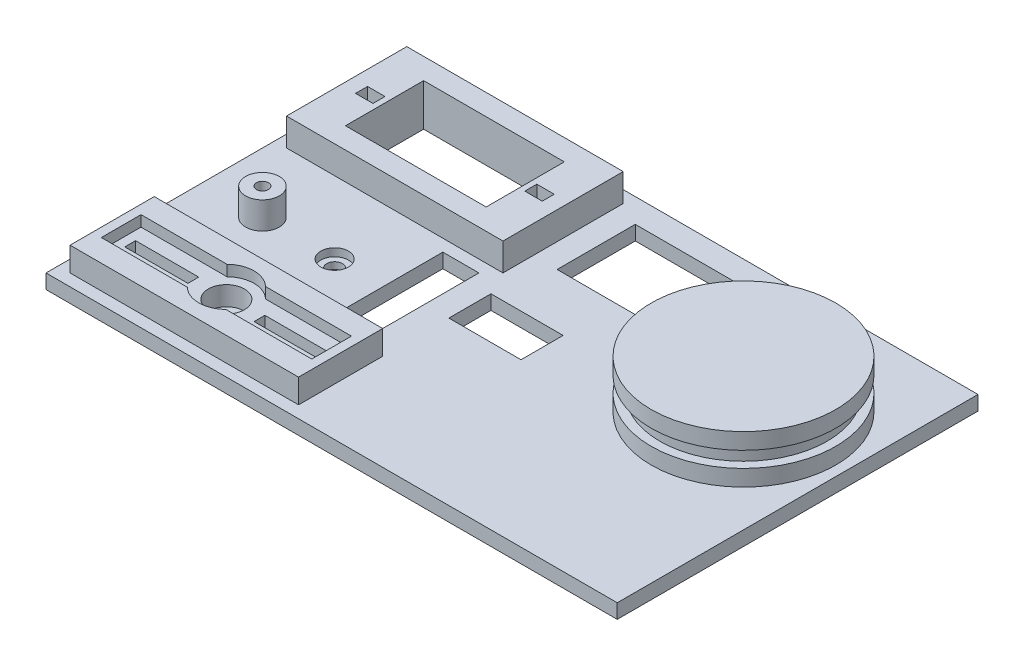
from build123d import *

# Parameters (mm, degrees)
SKETCH1_W            = 95
SKETCH1_H            = 2.4
BOSS_EXTRUDE1_DEPTH  = 60
BOSS_EXTRUDE2_START  = 2
SKETCH2_W            = 36
SKETCH2_H            = 4.6
BOSS_EXTRUDE2_DEPTH  = 20
BOSS_EXTRUDE3_START  = 5.5
SKETCH3_W            = 23.4
SKETCH3_H            = 9
BOSS_EXTRUDE3_DEPTH  = 13
BOSS_EXTRUDE4_START  = 11
SKETCH4_W            = 2.9
SKETCH4_H            = 9
BOSS_EXTRUDE4_DEPTH  = 2
BOSS_EXTRUDE5_START  = 11
SKETCH5_W            = 2.9
SKETCH5_H            = 9
BOSS_EXTRUDE5_DEPTH  = 2
BOSS_EXTRUDE6_START  = 4
SKETCH6_W            = 19.4
SKETCH6_H            = 4.4
BOSS_EXTRUDE6_DEPTH  = 13
BOSS_EXTRUDE7_START  = 2.4
SKETCH7_R            = 2.8
BOSS_EXTRUDE7_DEPTH  = 4.5
BOSS_EXTRUDE8_START  = 1.6
SKETCH8_R            = 1
BOSS_EXTRUDE8_DEPTH  = 6.3
BOSS_EXTRUDE9_START  = -1
SKETCH9_R            = 1.3
BOSS_EXTRUDE9_DEPTH  = 4.4
BOSS_EXTRUDE10_START = 1.1
SKETCH10_R           = 2.3
BOSS_EXTRUDE10_DEPTH = 2.3
BOSS_EXTRUDE11_START = 24
SKETCH11_W           = 6
SKETCH11_H           = 4.4
BOSS_EXTRUDE11_DEPTH = 17
BOSS_EXTRUDE12_START = 26
SKETCH12_W           = 12
SKETCH12_H           = 4.4
BOSS_EXTRUDE12_DEPTH = 7
BOSS_EXTRUDE13_START = 2.4
SKETCH13_R           = 15.35
BOSS_EXTRUDE13_DEPTH = 8
BOSS_EXTRUDE14_START = 5.1
SKETCH14_R           = 20
BOSS_EXTRUDE14_DEPTH = 2.6
BOSS_EXTRUDE15_START = 5.1
SKETCH15_R           = 13.9
BOSS_EXTRUDE15_DEPTH = 2.6
BOSS_EXTRUDE16_START = 44
SKETCH16_W           = 38
SKETCH16_H           = 4
BOSS_EXTRUDE16_DEPTH = 14
BOSS_EXTRUDE17_START = 4.6
SKETCH17_R           = 4.6
BOSS_EXTRUDE17_DEPTH = 2.3
BOSS_EXTRUDE18_START = 47.7
SKETCH18_W           = 17.5
SKETCH18_H           = 2.3
BOSS_EXTRUDE18_DEPTH = 6.6
BOSS_EXTRUDE19_START = 50.1
SKETCH19_W           = 10.5
SKETCH19_H           = 6
BOSS_EXTRUDE19_DEPTH = 1.8
BOSS_EXTRUDE20_START = 47.7
SKETCH20_W           = 17.5
SKETCH20_H           = 2.3
BOSS_EXTRUDE20_DEPTH = 6.6
BOSS_EXTRUDE21_START = 50.1
SKETCH21_W           = 10.5
SKETCH21_H           = 6
BOSS_EXTRUDE21_DEPTH = 1.8
BOSS_EXTRUDE22_START = 1.4
SKETCH22_R           = 3
BOSS_EXTRUDE22_DEPTH = 6


with BuildPart() as part:
    # Sketch1 → Boss-Extrude1 (new body)
    with BuildSketch(Plane.XY):
        with Locations((197.5, 1.2)):
            Rectangle(SKETCH1_W, SKETCH1_H)
    extrude(amount=BOSS_EXTRUDE1_DEPTH)

    # Sketch2 → Boss-Extrude2 (add)
    with BuildSketch(Plane.XY.offset(BOSS_EXTRUDE2_START)):
        with Locations((170, 4.7)):
            Rectangle(SKETCH2_W, SKETCH2_H)
    extrude(amount=BOSS_EXTRUDE2_DEPTH)


with BuildPart() as body_2:
    # Sketch3 → Boss-Extrude3 (new body)
    with BuildSketch(Plane.XY.offset(BOSS_EXTRUDE3_START)):
        with Locations((170, 3.5)):
            Rectangle(SKETCH3_W, SKETCH3_H)
    extrude(amount=BOSS_EXTRUDE3_DEPTH)


with BuildPart() as part_1:
    add(part.part)

    # Combine1: cut body 2
    add(body_2.part, mode=Mode.SUBTRACT)


with BuildPart() as body_2_2:
    # Sketch4 → Boss-Extrude4 (new body)
    with BuildSketch(Plane.XY.offset(BOSS_EXTRUDE4_START)):
        with Locations((155.925, 3.5)):
            Rectangle(SKETCH4_W, SKETCH4_H)
    extrude(amount=BOSS_EXTRUDE4_DEPTH)


with BuildPart() as part_2:
    add(part_1.part)

    # Combine2: cut body 2 2
    add(body_2_2.part, mode=Mode.SUBTRACT)


with BuildPart() as body_2_3:
    # Sketch5 → Boss-Extrude5 (new body)
    with BuildSketch(Plane.XY.offset(BOSS_EXTRUDE5_START)):
        with Locations((184.075, 3.5)):
            Rectangle(SKETCH5_W, SKETCH5_H)
    extrude(amount=BOSS_EXTRUDE5_DEPTH)


with BuildPart() as part_3:
    add(part_2.part)

    # Combine3: cut body 2 3
    add(body_2_3.part, mode=Mode.SUBTRACT)


with BuildPart() as body_2_4:
    # Sketch6 → Boss-Extrude6 (new body)
    with BuildSketch(Plane.XY.offset(BOSS_EXTRUDE6_START)):
        with Locations((201.7, 1.2)):
            Rectangle(SKETCH6_W, SKETCH6_H)
    extrude(amount=BOSS_EXTRUDE6_DEPTH)


with BuildPart() as part_4:
    add(part_3.part)

    # Combine4: cut body 2 4
    add(body_2_4.part, mode=Mode.SUBTRACT)

    # Sketch7 → Boss-Extrude7 (add)
    with BuildSketch(Plane(origin=(0, 0, 0), x_dir=(1, 0, 0), z_dir=(0, 1, 0)).offset(BOSS_EXTRUDE7_START)):
        with Locations(Location((160, -34, 0), (0, 0, 90))):
            Circle(SKETCH7_R)
    extrude(amount=BOSS_EXTRUDE7_DEPTH)


with BuildPart() as body_2_5:
    # Sketch8 → Boss-Extrude8 (new body)
    with BuildSketch(Plane(origin=(0, 0, 0), x_dir=(1, 0, 0), z_dir=(0, 1, 0)).offset(BOSS_EXTRUDE8_START)):
        with Locations(Location((160, -34, 0), (0, 0, 270))):
            Circle(SKETCH8_R)
    extrude(amount=BOSS_EXTRUDE8_DEPTH)


with BuildPart() as part_5:
    add(part_4.part)

    # Combine5: cut body 2 5
    add(body_2_5.part, mode=Mode.SUBTRACT)


with BuildPart() as body_2_6:
    # Sketch9 → Boss-Extrude9 (new body)
    with BuildSketch(Plane(origin=(0, 0, 0), x_dir=(1, 0, 0), z_dir=(0, 1, 0)).offset(BOSS_EXTRUDE9_START)):
        with Locations(Location((172, -34, 0), (0, 0, 270))):
            Circle(SKETCH9_R)
    extrude(amount=BOSS_EXTRUDE9_DEPTH)


with BuildPart() as part_6:
    add(part_5.part)

    # Combine6: cut body 2 6
    add(body_2_6.part, mode=Mode.SUBTRACT)


with BuildPart() as body_2_7:
    # Sketch10 → Boss-Extrude10 (new body)
    with BuildSketch(Plane(origin=(0, 0, 0), x_dir=(1, 0, 0), z_dir=(0, 1, 0)).offset(BOSS_EXTRUDE10_START)):
        with Locations(Location((172, -34, 0), (0, 0, 270))):
            Circle(SKETCH10_R)
    extrude(amount=BOSS_EXTRUDE10_DEPTH)


with BuildPart() as part_7:
    add(part_6.part)

    # Combine7: cut body 2 7
    add(body_2_7.part, mode=Mode.SUBTRACT)


with BuildPart() as body_2_8:
    # Sketch11 → Boss-Extrude11 (new body)
    with BuildSketch(Plane.XY.offset(BOSS_EXTRUDE11_START)):
        with Locations((183, 1.2)):
            Rectangle(SKETCH11_W, SKETCH11_H)
    extrude(amount=BOSS_EXTRUDE11_DEPTH)


with BuildPart() as part_8:
    add(part_7.part)

    # Combine8: cut body 2 8
    add(body_2_8.part, mode=Mode.SUBTRACT)


with BuildPart() as body_2_9:
    # Sketch12 → Boss-Extrude12 (new body)
    with BuildSketch(Plane.XY.offset(BOSS_EXTRUDE12_START)):
        with Locations((196, 1.2)):
            Rectangle(SKETCH12_W, SKETCH12_H)
    extrude(amount=BOSS_EXTRUDE12_DEPTH)


with BuildPart() as part_9:
    add(part_8.part)

    # Combine9: cut body 2 9
    add(body_2_9.part, mode=Mode.SUBTRACT)

    # Sketch13 → Boss-Extrude13 (add)
    with BuildSketch(Plane(origin=(0, 0, 0), x_dir=(1, 0, 0), z_dir=(0, 1, 0)).offset(BOSS_EXTRUDE13_START)):
        with Locations(Location((228, -22, 0), (0, 0, 90))):
            Circle(SKETCH13_R)
    extrude(amount=BOSS_EXTRUDE13_DEPTH)


with BuildPart() as body_2_10:
    # Sketch14 → Boss-Extrude14 (new body)
    with BuildSketch(Plane(origin=(0, 0, 0), x_dir=(1, 0, 0), z_dir=(0, 1, 0)).offset(BOSS_EXTRUDE14_START)):
        with Locations(Location((228, -22, 0), (0, 0, 270))):
            Circle(SKETCH14_R)
    extrude(amount=BOSS_EXTRUDE14_DEPTH)


with BuildPart() as part_10:
    add(part_9.part)

    # Combine10: cut body 2 10
    add(body_2_10.part, mode=Mode.SUBTRACT)

    # Sketch15 → Boss-Extrude15 (add)
    with BuildSketch(Plane(origin=(0, 0, 0), x_dir=(1, 0, 0), z_dir=(0, 1, 0)).offset(BOSS_EXTRUDE15_START)):
        with Locations(Location((228, -22, 0), (0, 0, 270))):
            Circle(SKETCH15_R)
    extrude(amount=BOSS_EXTRUDE15_DEPTH)

    # Sketch16 → Boss-Extrude16 (add)
    with BuildSketch(Plane.XY.offset(BOSS_EXTRUDE16_START)):
        with Locations((171, 4.4)):
            Rectangle(SKETCH16_W, SKETCH16_H)
    extrude(amount=BOSS_EXTRUDE16_DEPTH)


with BuildPart() as body_2_11:
    # Sketch17 → Boss-Extrude17 (new body)
    with BuildSketch(Plane(origin=(0, 0, 0), x_dir=(1, 0, 0), z_dir=(0, 1, 0)).offset(BOSS_EXTRUDE17_START)):
        with Locations(Location((171, -51, 0), (0, 0, 270))):
            Circle(SKETCH17_R)
    extrude(amount=BOSS_EXTRUDE17_DEPTH)


with BuildPart() as part_11:
    add(part_10.part)

    # Combine11: cut body 2 11
    add(body_2_11.part, mode=Mode.SUBTRACT)


with BuildPart() as body_2_12:
    # Sketch18 → Boss-Extrude18 (new body)
    with BuildSketch(Plane.XY.offset(BOSS_EXTRUDE18_START)):
        with Locations((179.75, 5.75)):
            Rectangle(SKETCH18_W, SKETCH18_H)
    extrude(amount=BOSS_EXTRUDE18_DEPTH)


with BuildPart() as part_12:
    add(part_11.part)

    # Combine12: cut body 2 12
    add(body_2_12.part, mode=Mode.SUBTRACT)


with BuildPart() as body_2_13:
    # Sketch19 → Boss-Extrude19 (new body)
    with BuildSketch(Plane.XY.offset(BOSS_EXTRUDE19_START)):
        with Locations((181.75, 4.4)):
            Rectangle(SKETCH19_W, SKETCH19_H)
    extrude(amount=BOSS_EXTRUDE19_DEPTH)


with BuildPart() as part_13:
    add(part_12.part)

    # Combine13: cut body 2 13
    add(body_2_13.part, mode=Mode.SUBTRACT)


with BuildPart() as body_2_14:
    # Sketch20 → Boss-Extrude20 (new body)
    with BuildSketch(Plane.XY.offset(BOSS_EXTRUDE20_START)):
        with Locations((162.25, 5.75)):
            Rectangle(SKETCH20_W, SKETCH20_H)
    extrude(amount=BOSS_EXTRUDE20_DEPTH)


with BuildPart() as part_14:
    add(part_13.part)

    # Combine14: cut body 2 14
    add(body_2_14.part, mode=Mode.SUBTRACT)


with BuildPart() as body_2_15:
    # Sketch21 → Boss-Extrude21 (new body)
    with BuildSketch(Plane.XY.offset(BOSS_EXTRUDE21_START)):
        with Locations((160.25, 4.4)):
            Rectangle(SKETCH21_W, SKETCH21_H)
    extrude(amount=BOSS_EXTRUDE21_DEPTH)


with BuildPart() as part_15:
    add(part_14.part)

    # Combine15: cut body 2 15
    add(body_2_15.part, mode=Mode.SUBTRACT)


with BuildPart() as body_2_16:
    # Sketch22 → Boss-Extrude22 (new body)
    with BuildSketch(Plane(origin=(0, 0, 0), x_dir=(1, 0, 0), z_dir=(0, 1, 0)).offset(BOSS_EXTRUDE22_START)):
        with Locations(Location((171, -51, 0), (0, 0, 270))):
            Circle(SKETCH22_R)
    extrude(amount=BOSS_EXTRUDE22_DEPTH)


with BuildPart() as part_16:
    add(part_15.part)

    # Combine16: cut body 2 16
    add(body_2_16.part, mode=Mode.SUBTRACT)


solid = part_16.part
